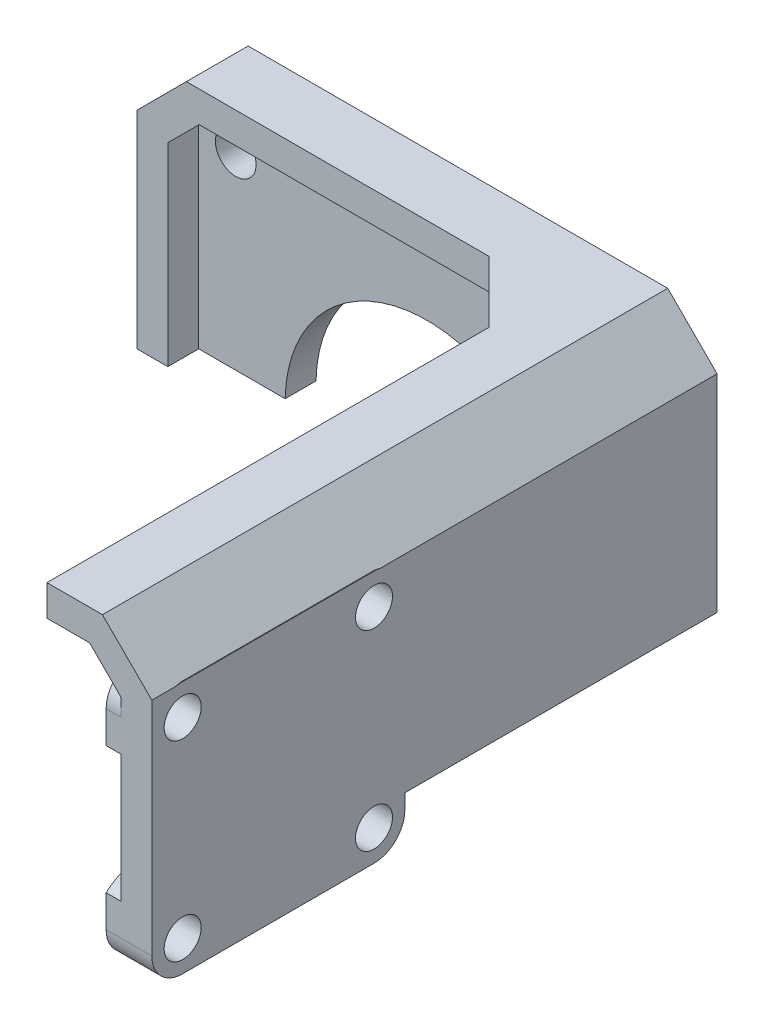
from build123d import *

# Parameters (mm, degrees)
BOSS_EXTRUDE1_DEPTH     = 2.5
SKETCH2_R               = 11.5
CUT_EXTRUDE1_DEPTH      = 3
SKETCH3_R               = 1.65
CUT_EXTRUDE2_DEPTH      = 3
EXTRUDE_THIN1_DEPTH     = 43.3
BOSS_EXTRUDE2_DEPTH     = 2.5
CUT_EXTRUDE3_DEPTH      = 57.003950753
CUT_EXTRUDE3_DEPTH_BACK = 57.003950753
SKETCH7_W               = 33.5
SKETCH7_H               = 40.8
CHAMFER1_SIZE           = 5
BOSS_EXTRUDE3_DEPTH     = 1.2
SKETCH10_R              = 1.5
CUT_EXTRUDE4_DEPTH      = 10
SKETCH12_W              = 9.502717712
SKETCH12_H              = 19.3
BOSS_EXTRUDE4_DEPTH     = 5
SKETCH13_R              = 1.5
CUT_EXTRUDE5_DEPTH      = 53.789227121


with BuildPart() as part:
    # Sketch1 → Boss-Extrude1 (new body)
    with BuildSketch(Plane.XY):
        Polygon((-21, 0.25), (21, 0.25), (21, 17), (17, 21), (-17, 21), (-21, 17), align=None)
    extrude(amount=BOSS_EXTRUDE1_DEPTH)

    # Sketch2 → Cut-Extrude1 (cut)
    with BuildSketch(Plane.XY.offset(2.5)):
        Circle(SKETCH2_R)
    extrude(amount=-CUT_EXTRUDE1_DEPTH, mode=Mode.SUBTRACT)

    # Sketch3 → Cut-Extrude2 (cut)
    with BuildSketch(Plane(origin=(0, 0, 0), x_dir=(-1, 0, 0), z_dir=(0, 0, -1))):
        with Locations((15.5, 15.5)):
            Circle(SKETCH3_R)
        with Locations((-15.5, 15.5)):
            Circle(SKETCH3_R)
    extrude(amount=-CUT_EXTRUDE2_DEPTH, mode=Mode.SUBTRACT)

    # Sketch4 → Extrude-Thin1 (add)
    with BuildSketch(Plane.XY.offset(2.5)):
        Polygon((21, 0.25), (21, 17), (17, 21), (-17, 21), (-21, 17), (-21, 0.25), (-18.5, 0.25), (-18.5, 15.964466094), (-15.964466094, 18.5), (15.964466094, 18.5), (18.5, 15.964466094), (18.5, 0.25), align=None)
    extrude(amount=EXTRUDE_THIN1_DEPTH)

    # Sketch6 → Boss-Extrude2 (add)
    with BuildSketch(Plane(origin=(21, 0, 0), x_dir=(0, 0, -1), z_dir=(1, 0, 0))):
        with BuildLine():
            Line((-45.8, 14.55), (-45.8, -0.95))
            ThreePointArc((-45.8, -0.95), (-45.067766953, -2.717766953), (-43.3, -3.45))
            Line((-43.3, -3.45), (-27.8, -3.45))
            ThreePointArc((-27.8, -3.45), (-26.032233047, -2.717766953), (-25.3, -0.95))
            Line((-25.3, -0.95), (-25.3, 14.55))
            ThreePointArc((-25.3, 14.55), (-26.032233047, 16.317766953), (-27.8, 17.05))
            Line((-27.8, 17.05), (-43.3, 17.05))
            ThreePointArc((-43.3, 17.05), (-45.067766953, 16.317766953), (-45.8, 14.55))
        make_face()
    extrude(amount=-BOSS_EXTRUDE2_DEPTH)

    # Sketch7 → Cut-Extrude3 (cut, two sides: drawn at the far end of the back side and taken through both)
    with BuildSketch(Plane(origin=(0, 21, 0), x_dir=(1, 0, 0), z_dir=(0, 1, 0)).offset(-CUT_EXTRUDE3_DEPTH_BACK)):
        with Locations((-4.25, -25.4)):
            Rectangle(SKETCH7_W, SKETCH7_H)
    extrude(amount=CUT_EXTRUDE3_DEPTH + CUT_EXTRUDE3_DEPTH_BACK, mode=Mode.SUBTRACT)

    # Chamfer1
    chamfer1_edges = [part.edges().sort_by_distance(p)[0] for p in [
        (12.5, 19.75, 5),
    ]]
    chamfer(chamfer1_edges, length=CHAMFER1_SIZE)

    # Sketch8 → Boss-Extrude3 (add)
    with BuildSketch(Plane.ZY.offset(-18.5)):
        with BuildLine():
            Line((27.8, -3.45), (30.390366769, -3.45))
            ThreePointArc((30.390366769, -3.45), (30.345584412, 1.595584412), (25.3, 1.640366769))
            Line((25.3, 1.640366769), (25.3, -0.95))
            ThreePointArc((25.3, -0.95), (26.032233047, -2.717766953), (27.8, -3.45))
        make_face()
        with BuildLine():
            Line((45.8, -0.95), (45.8, 1.640366769))
            ThreePointArc((45.8, 1.640366769), (40.754415588, 1.595584412), (40.709633231, -3.45))
            Line((40.709633231, -3.45), (43.3, -3.45))
            ThreePointArc((43.3, -3.45), (45.067766953, -2.717766953), (45.8, -0.95))
        make_face()
        with BuildLine():
            Line((43.3, 17.05), (40.709633231, 17.05))
            ThreePointArc((40.709633231, 17.05), (40.754415588, 12.004415588), (45.8, 11.959633231))
            Line((45.8, 11.959633231), (45.8, 14.55))
            ThreePointArc((45.8, 14.55), (45.067766953, 16.317766953), (43.3, 17.05))
        make_face()
        with BuildLine():
            Line((25.3, 14.55), (25.3, 11.959633231))
            ThreePointArc((25.3, 11.959633231), (30.345584412, 12.004415588), (30.390366769, 17.05))
            Line((30.390366769, 17.05), (27.8, 17.05))
            ThreePointArc((27.8, 17.05), (26.032233047, 16.317766953), (25.3, 14.55))
        make_face()
    extrude(amount=BOSS_EXTRUDE3_DEPTH)

    # Sketch10 → Cut-Extrude4 (cut)
    with BuildSketch(Plane.ZY.offset(-17.3)):
        with Locations((43.3, 14.55)):
            Circle(SKETCH10_R)
        with Locations((27.8, 14.55)):
            Circle(SKETCH10_R)
        with Locations((27.8, -0.95)):
            Circle(SKETCH10_R)
        with Locations((43.3, -0.95)):
            Circle(SKETCH10_R)
    extrude(amount=-CUT_EXTRUDE4_DEPTH, mode=Mode.SUBTRACT)

    # Sketch12 → Boss-Extrude4 (add)
    with BuildSketch(Plane.XZ.offset(-0.25)):
        with Locations((16.248641144, 9.65)):
            Rectangle(SKETCH12_W, SKETCH12_H)
    extrude(amount=-BOSS_EXTRUDE4_DEPTH)

    # Sketch13 → Cut-Extrude5 (cut, through all)
    with BuildSketch(Plane(origin=(0, 5.25, 0), x_dir=(1, 0, 0), z_dir=(0, 1, 0))):
        with Locations(Location((14.998641144, -15.8, 0), (0, 0, 270))):
            Circle(SKETCH13_R)
    extrude(amount=-CUT_EXTRUDE5_DEPTH, mode=Mode.SUBTRACT)


solid = part.part
